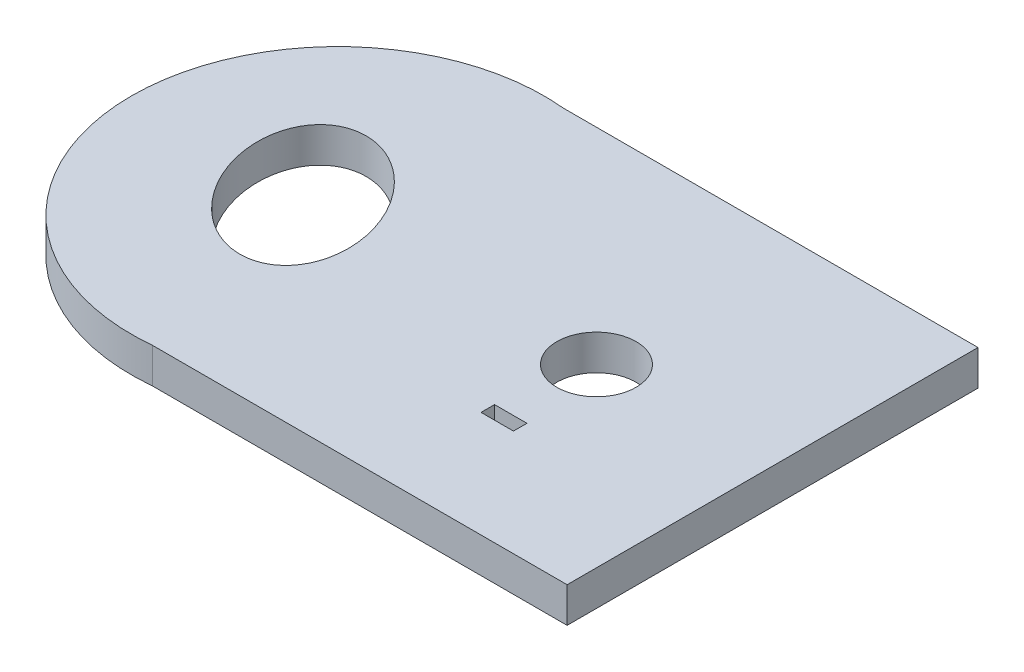
from build123d import *

# Parameters (mm, degrees)
SKETCH1_R           = 3.375
SKETCH1_RX          = 7.5
SKETCH1_RY          = 5.3
SKETCH1_W           = 2.76
SKETCH1_H           = 1.15
BOSS_EXTRUDE1_DEPTH = 3


with BuildPart() as part:
    # Sketch1 → Boss-Extrude1 (new body)
    with BuildSketch(Plane(origin=(0, 0, 0), x_dir=(1, 0, 0), z_dir=(0, 1, 0))):
        with BuildLine():
            Line((0, 0), (35.332576055, 0))
            Line((35.332576055, 0), (35.332576055, -35))
            Line((35.332576055, -35), (0, -35))
            ThreePointArc((0, -35), (-19.284551552, -17.5), (0, 0))
        make_face()
        with Locations(Location((20.332576055, -17.5, 0), (0, 0, 270))):
            Circle(SKETCH1_R, mode=Mode.SUBTRACT)
        with Locations(Location((-4.667423945, -17.5), (0, 0, 118.629649839))):
            Ellipse(SKETCH1_RX, SKETCH1_RY, mode=Mode.SUBTRACT)
        with Locations((20.332576055, -25.378095587)):
            Rectangle(SKETCH1_W, SKETCH1_H, mode=Mode.SUBTRACT)
    extrude(amount=BOSS_EXTRUDE1_DEPTH)


solid = part.part
